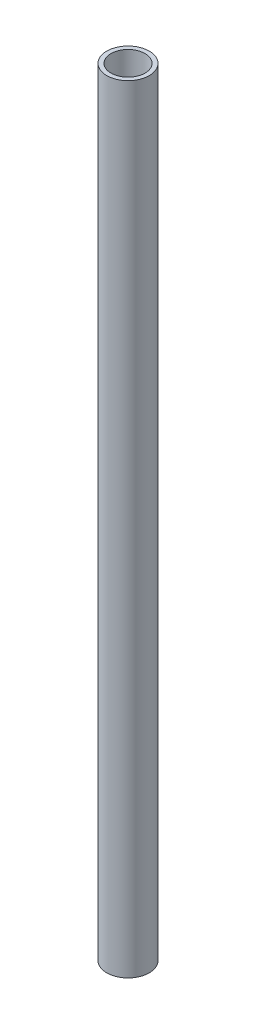
from build123d import *

# Parameters (mm, degrees)
SKETCH1_R           = 25
SKETCH1_R_2         = 20
BOSS_EXTRUDE1_DEPTH = 914.4


with BuildPart() as part:
    # Sketch1 → Boss-Extrude1 (new body)
    with BuildSketch(Plane(origin=(0, 0, 0), x_dir=(1, 0, 0), z_dir=(0, 1, 0))):
        with Locations(Location((0, 0, 0), (0, 0, 90))):
            Circle(SKETCH1_R)
        with Locations(Location((0, 0, 0), (0, 0, 90))):
            Circle(SKETCH1_R_2, mode=Mode.SUBTRACT)
    extrude(amount=BOSS_EXTRUDE1_DEPTH)


solid = part.part
